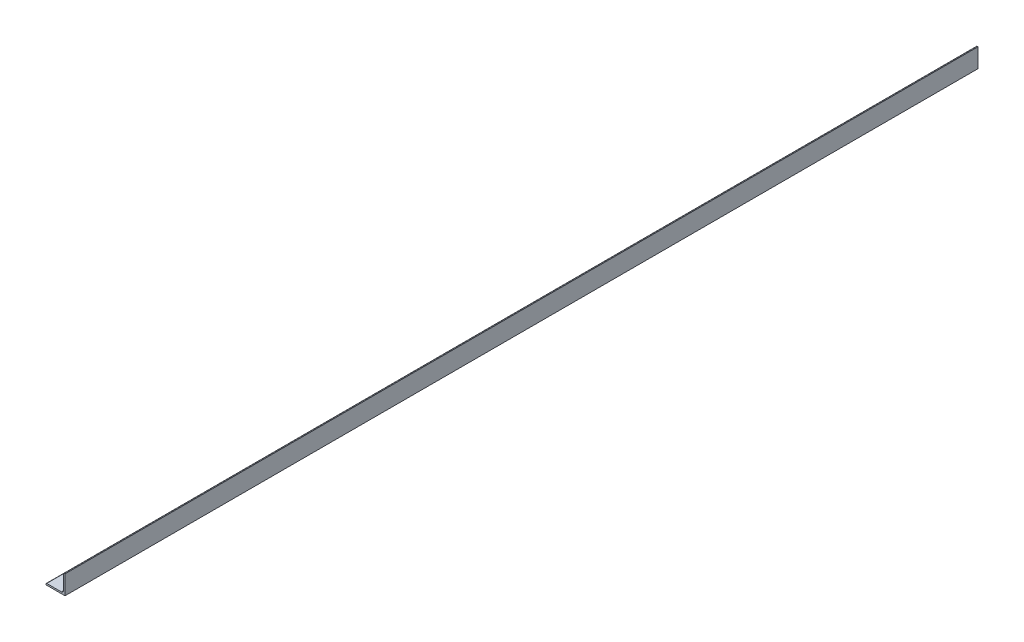
from build123d import *

# Parameters (mm, degrees)
BOSS_EXTRUDE1_DEPTH = 457.2


with BuildPart() as part:
    # Sketch2 → Boss-Extrude1 (new, symmetric)
    with BuildSketch(Plane.XY):
        with BuildLine():
            Line((-9.525, -9.525), (9.525, -9.525))
            Line((9.525, -9.525), (9.525, 9.525))
            Line((9.525, 9.525), (8.73125, 9.525))
            ThreePointArc((8.73125, 9.525), (8.169983992, 9.292516008), (7.9375, 8.73125))
            Line((7.9375, 8.73125), (7.9375, -5.5499))
            ThreePointArc((7.9375, -5.5499), (7.238188151, -7.238188151), (5.5499, -7.9375))
            Line((5.5499, -7.9375), (-8.73125, -7.9375))
            ThreePointArc((-8.73125, -7.9375), (-9.292516008, -8.169983992), (-9.525, -8.73125))
            Line((-9.525, -8.73125), (-9.525, -9.525))
        make_face()
    extrude(amount=BOSS_EXTRUDE1_DEPTH, both=True)


solid = part.part
